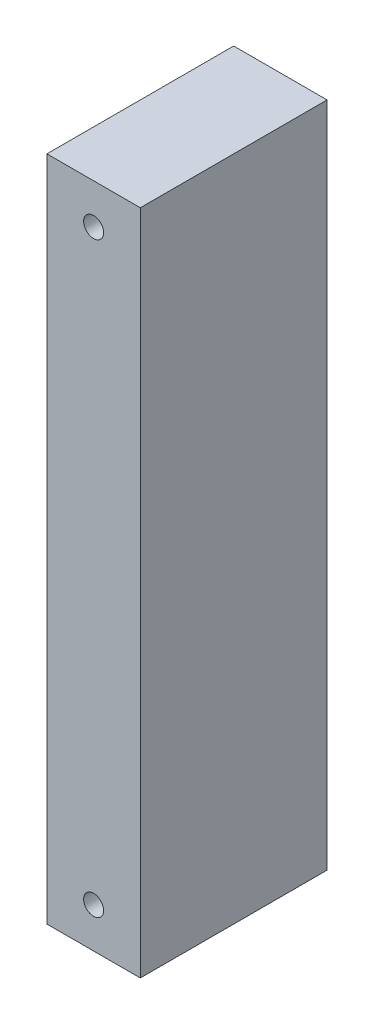
from build123d import *

# Parameters (mm, degrees)
SKETCH1_W           = 7
SKETCH1_H           = 50
SKETCH1_R           = 0.75
BOSS_EXTRUDE1_DEPTH = 14


with BuildPart() as part:
    # Sketch1 → Boss-Extrude1 (new body)
    with BuildSketch(Plane.XY):
        Rectangle(SKETCH1_W, SKETCH1_H)
        with Locations((0, 22)):
            Circle(SKETCH1_R, mode=Mode.SUBTRACT)
        with Locations((0, -22)):
            Circle(SKETCH1_R, mode=Mode.SUBTRACT)
    extrude(amount=BOSS_EXTRUDE1_DEPTH)


solid = part.part
